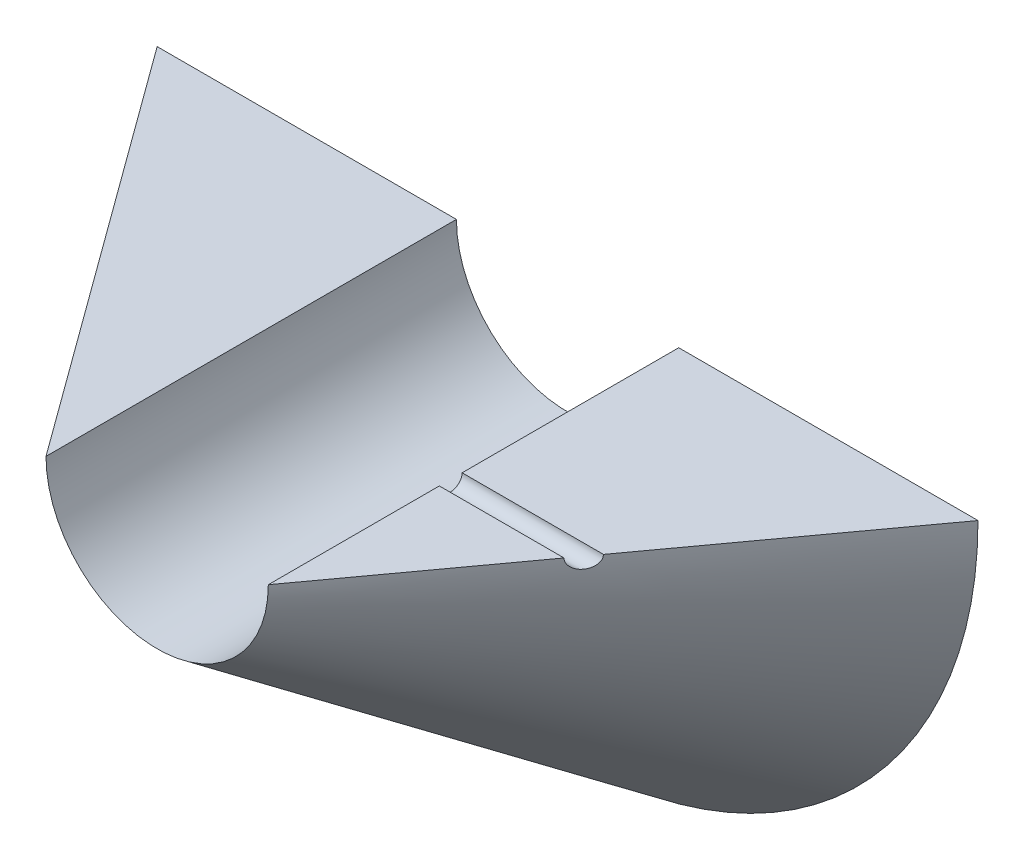
from build123d import *

# Parameters (mm, degrees)
ENL_V_MAT_EXTRU_1_REACH = 313.769
ESQUISSE7_R             = 5


with BuildPart() as part:
    # Esquisse4 → Révolution1 (revolve)
    with BuildSketch(Plane(origin=(0, 0, 0), x_dir=(0, 0, -1), z_dir=(1, 0, 0)), mode=Mode.PRIVATE) as r_volution1_sk:
        Polygon((-180, 48.75), (0, 180), (0, 48.75), align=None)
    revolve(r_volution1_sk.sketch.rotate(Axis((0, 0, 180), (0, 0, -1)), 90), axis=Axis((0, 0, 180), (0, 0, -1)))

    # Enlèv. mat.-Extru.1: up to this cone (the profile starts inside it)
    enl_v_mat_extru_1_end = Plane(origin=(0, 0, 100), z_dir=(0, 0, -1)).offset(-146.857141857) * Cone(1e-06, 414.319409722, 568.20947519, align=(Align.CENTER, Align.CENTER, Align.MIN), mode=Mode.PRIVATE)
    # Esquisse7 → Enlèv. mat.-Extru.1 (cut, up to the surface)
    with BuildSketch(Plane(origin=(0, 0, 0), x_dir=(0, 0, -1), z_dir=(1, 0, 0)), mode=Mode.PRIVATE) as enl_v_mat_extru_1_sk1:
        with Locations(Location((-100, 0, 0), (0, 0, 180))):
            Circle(ESQUISSE7_R)
    enl_v_mat_extru_1_tool1 = extrude(enl_v_mat_extru_1_sk1.sketch, amount=ENL_V_MAT_EXTRU_1_REACH, mode=Mode.PRIVATE) & enl_v_mat_extru_1_end
    add(enl_v_mat_extru_1_tool1.solids().sort_by_distance((0, 0, 100))[0], mode=Mode.SUBTRACT)

    # Enlèv. mat.-Surface1
    split(bisect_by=Plane(origin=(0, 0, 0), x_dir=(1, 0, 0), z_dir=(0, 1, 0)), keep=Keep.BOTTOM)


solid = part.part
